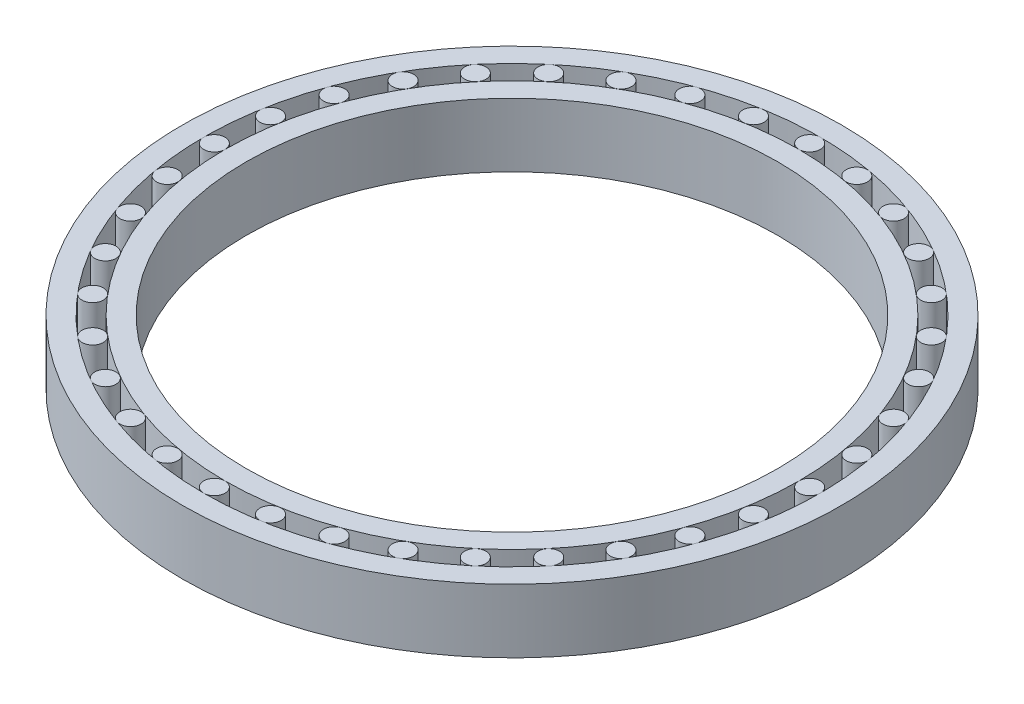
from build123d import *

# Parameters (mm, degrees)
SKETCH_1_R                = 27
SKETCH_1_R_2              = 25
EXTRUDE_1_DEPTH           = 6
SKETCH_2_R                = 31
SKETCH_2_R_2              = 29
EXTRUDE_2_DEPTH           = 6
SKETCH_3_R                = 1
EXTRUDE_3_DEPTH           = 6
PATTERN_CIRCULAR_25_COUNT = 36


with BuildPart() as part:
    # 草图1 → 凸台-拉伸1 (new body)
    with BuildSketch(Plane(origin=(0, 0, 0), x_dir=(1, 0, 0), z_dir=(0, 1, 0))):
        with Locations(Location((0, 0, 0), (0, 0, 270))):
            Circle(SKETCH_1_R)
        with Locations(Location((0, 0, 0), (0, 0, 270))):
            Circle(SKETCH_1_R_2, mode=Mode.SUBTRACT)
    extrude(amount=EXTRUDE_1_DEPTH)


with BuildPart() as body_2:
    # 草图2 → 凸台-拉伸2 (new body)
    with BuildSketch(Plane(origin=(0, 0, 0), x_dir=(1, 0, 0), z_dir=(0, 1, 0))):
        with Locations(Location((0, 0, 0), (0, 0, 270))):
            Circle(SKETCH_2_R)
        with Locations(Location((0, 0, 0), (0, 0, 270))):
            Circle(SKETCH_2_R_2, mode=Mode.SUBTRACT)
    extrude(amount=EXTRUDE_2_DEPTH)


with BuildPart() as body_3:
    # 草图3 → 凸台-拉伸3 (new body)
    with BuildSketch(Plane(origin=(0, 0, 0), x_dir=(1, 0, 0), z_dir=(0, 1, 0))):
        with Locations(Location((-28, 0, 0), (0, 0, 270))):
            Circle(SKETCH_3_R)
    extrude(amount=EXTRUDE_3_DEPTH)


with BuildPart() as pattern_circular_25_1:
    # 阵列(圆周)25: pattern copy
    add(body_3.part.rotate(Axis((0, 0, 0), (0, 1, 0)), 1 * 360 / PATTERN_CIRCULAR_25_COUNT))


with BuildPart() as pattern_circular_25_2:
    # 阵列(圆周)25: pattern copy
    add(body_3.part.rotate(Axis((0, 0, 0), (0, 1, 0)), 2 * 360 / PATTERN_CIRCULAR_25_COUNT))


with BuildPart() as pattern_circular_25_3:
    # 阵列(圆周)25: pattern copy
    add(body_3.part.rotate(Axis((0, 0, 0), (0, 1, 0)), 3 * 360 / PATTERN_CIRCULAR_25_COUNT))


with BuildPart() as pattern_circular_25_4:
    # 阵列(圆周)25: pattern copy
    add(body_3.part.rotate(Axis((0, 0, 0), (0, 1, 0)), 4 * 360 / PATTERN_CIRCULAR_25_COUNT))


with BuildPart() as pattern_circular_25_5:
    # 阵列(圆周)25: pattern copy
    add(body_3.part.rotate(Axis((0, 0, 0), (0, 1, 0)), 5 * 360 / PATTERN_CIRCULAR_25_COUNT))


with BuildPart() as pattern_circular_25_6:
    # 阵列(圆周)25: pattern copy
    add(body_3.part.rotate(Axis((0, 0, 0), (0, 1, 0)), 6 * 360 / PATTERN_CIRCULAR_25_COUNT))


with BuildPart() as pattern_circular_25_7:
    # 阵列(圆周)25: pattern copy
    add(body_3.part.rotate(Axis((0, 0, 0), (0, 1, 0)), 7 * 360 / PATTERN_CIRCULAR_25_COUNT))


with BuildPart() as pattern_circular_25_8:
    # 阵列(圆周)25: pattern copy
    add(body_3.part.rotate(Axis((0, 0, 0), (0, 1, 0)), 8 * 360 / PATTERN_CIRCULAR_25_COUNT))


with BuildPart() as pattern_circular_25_9:
    # 阵列(圆周)25: pattern copy
    add(body_3.part.rotate(Axis((0, 0, 0), (0, 1, 0)), 9 * 360 / PATTERN_CIRCULAR_25_COUNT))


with BuildPart() as pattern_circular_25_10:
    # 阵列(圆周)25: pattern copy
    add(body_3.part.rotate(Axis((0, 0, 0), (0, 1, 0)), 10 * 360 / PATTERN_CIRCULAR_25_COUNT))


with BuildPart() as pattern_circular_25_11:
    # 阵列(圆周)25: pattern copy
    add(body_3.part.rotate(Axis((0, 0, 0), (0, 1, 0)), 11 * 360 / PATTERN_CIRCULAR_25_COUNT))


with BuildPart() as pattern_circular_25_12:
    # 阵列(圆周)25: pattern copy
    add(body_3.part.rotate(Axis((0, 0, 0), (0, 1, 0)), 12 * 360 / PATTERN_CIRCULAR_25_COUNT))


with BuildPart() as pattern_circular_25_13:
    # 阵列(圆周)25: pattern copy
    add(body_3.part.rotate(Axis((0, 0, 0), (0, 1, 0)), 13 * 360 / PATTERN_CIRCULAR_25_COUNT))


with BuildPart() as pattern_circular_25_14:
    # 阵列(圆周)25: pattern copy
    add(body_3.part.rotate(Axis((0, 0, 0), (0, 1, 0)), 14 * 360 / PATTERN_CIRCULAR_25_COUNT))


with BuildPart() as pattern_circular_25_15:
    # 阵列(圆周)25: pattern copy
    add(body_3.part.rotate(Axis((0, 0, 0), (0, 1, 0)), 15 * 360 / PATTERN_CIRCULAR_25_COUNT))


with BuildPart() as pattern_circular_25_16:
    # 阵列(圆周)25: pattern copy
    add(body_3.part.rotate(Axis((0, 0, 0), (0, 1, 0)), 16 * 360 / PATTERN_CIRCULAR_25_COUNT))


with BuildPart() as pattern_circular_25_17:
    # 阵列(圆周)25: pattern copy
    add(body_3.part.rotate(Axis((0, 0, 0), (0, 1, 0)), 17 * 360 / PATTERN_CIRCULAR_25_COUNT))


with BuildPart() as pattern_circular_25_18:
    # 阵列(圆周)25: pattern copy
    add(body_3.part.rotate(Axis((0, 0, 0), (0, 1, 0)), 18 * 360 / PATTERN_CIRCULAR_25_COUNT))


with BuildPart() as pattern_circular_25_19:
    # 阵列(圆周)25: pattern copy
    add(body_3.part.rotate(Axis((0, 0, 0), (0, 1, 0)), 19 * 360 / PATTERN_CIRCULAR_25_COUNT))


with BuildPart() as pattern_circular_25_20:
    # 阵列(圆周)25: pattern copy
    add(body_3.part.rotate(Axis((0, 0, 0), (0, 1, 0)), 20 * 360 / PATTERN_CIRCULAR_25_COUNT))


with BuildPart() as pattern_circular_25_21:
    # 阵列(圆周)25: pattern copy
    add(body_3.part.rotate(Axis((0, 0, 0), (0, 1, 0)), 21 * 360 / PATTERN_CIRCULAR_25_COUNT))


with BuildPart() as pattern_circular_25_22:
    # 阵列(圆周)25: pattern copy
    add(body_3.part.rotate(Axis((0, 0, 0), (0, 1, 0)), 22 * 360 / PATTERN_CIRCULAR_25_COUNT))


with BuildPart() as pattern_circular_25_23:
    # 阵列(圆周)25: pattern copy
    add(body_3.part.rotate(Axis((0, 0, 0), (0, 1, 0)), 23 * 360 / PATTERN_CIRCULAR_25_COUNT))


with BuildPart() as pattern_circular_25_24:
    # 阵列(圆周)25: pattern copy
    add(body_3.part.rotate(Axis((0, 0, 0), (0, 1, 0)), 24 * 360 / PATTERN_CIRCULAR_25_COUNT))


with BuildPart() as pattern_circular_25_25:
    # 阵列(圆周)25: pattern copy
    add(body_3.part.rotate(Axis((0, 0, 0), (0, 1, 0)), 25 * 360 / PATTERN_CIRCULAR_25_COUNT))


with BuildPart() as pattern_circular_25_26:
    # 阵列(圆周)25: pattern copy
    add(body_3.part.rotate(Axis((0, 0, 0), (0, 1, 0)), 26 * 360 / PATTERN_CIRCULAR_25_COUNT))


with BuildPart() as pattern_circular_25_27:
    # 阵列(圆周)25: pattern copy
    add(body_3.part.rotate(Axis((0, 0, 0), (0, 1, 0)), 27 * 360 / PATTERN_CIRCULAR_25_COUNT))


with BuildPart() as pattern_circular_25_28:
    # 阵列(圆周)25: pattern copy
    add(body_3.part.rotate(Axis((0, 0, 0), (0, 1, 0)), 28 * 360 / PATTERN_CIRCULAR_25_COUNT))


with BuildPart() as pattern_circular_25_29:
    # 阵列(圆周)25: pattern copy
    add(body_3.part.rotate(Axis((0, 0, 0), (0, 1, 0)), 29 * 360 / PATTERN_CIRCULAR_25_COUNT))


with BuildPart() as pattern_circular_25_30:
    # 阵列(圆周)25: pattern copy
    add(body_3.part.rotate(Axis((0, 0, 0), (0, 1, 0)), 30 * 360 / PATTERN_CIRCULAR_25_COUNT))


with BuildPart() as pattern_circular_25_31:
    # 阵列(圆周)25: pattern copy
    add(body_3.part.rotate(Axis((0, 0, 0), (0, 1, 0)), 31 * 360 / PATTERN_CIRCULAR_25_COUNT))


with BuildPart() as pattern_circular_25_32:
    # 阵列(圆周)25: pattern copy
    add(body_3.part.rotate(Axis((0, 0, 0), (0, 1, 0)), 32 * 360 / PATTERN_CIRCULAR_25_COUNT))


with BuildPart() as pattern_circular_25_33:
    # 阵列(圆周)25: pattern copy
    add(body_3.part.rotate(Axis((0, 0, 0), (0, 1, 0)), 33 * 360 / PATTERN_CIRCULAR_25_COUNT))


with BuildPart() as pattern_circular_25_34:
    # 阵列(圆周)25: pattern copy
    add(body_3.part.rotate(Axis((0, 0, 0), (0, 1, 0)), 34 * 360 / PATTERN_CIRCULAR_25_COUNT))


with BuildPart() as pattern_circular_25_35:
    # 阵列(圆周)25: pattern copy
    add(body_3.part.rotate(Axis((0, 0, 0), (0, 1, 0)), 35 * 360 / PATTERN_CIRCULAR_25_COUNT))


solid = Compound([part.part, body_2.part, body_3.part, pattern_circular_25_1.part, pattern_circular_25_2.part, pattern_circular_25_3.part, pattern_circular_25_4.part, pattern_circular_25_5.part, pattern_circular_25_6.part, pattern_circular_25_7.part, pattern_circular_25_8.part, pattern_circular_25_9.part, pattern_circular_25_10.part, pattern_circular_25_11.part, pattern_circular_25_12.part, pattern_circular_25_13.part, pattern_circular_25_14.part, pattern_circular_25_15.part, pattern_circular_25_16.part, pattern_circular_25_17.part, pattern_circular_25_18.part, pattern_circular_25_19.part, pattern_circular_25_20.part, pattern_circular_25_21.part, pattern_circular_25_22.part, pattern_circular_25_23.part, pattern_circular_25_24.part, pattern_circular_25_25.part, pattern_circular_25_26.part, pattern_circular_25_27.part, pattern_circular_25_28.part, pattern_circular_25_29.part, pattern_circular_25_30.part, pattern_circular_25_31.part, pattern_circular_25_32.part, pattern_circular_25_33.part, pattern_circular_25_34.part, pattern_circular_25_35.part])
